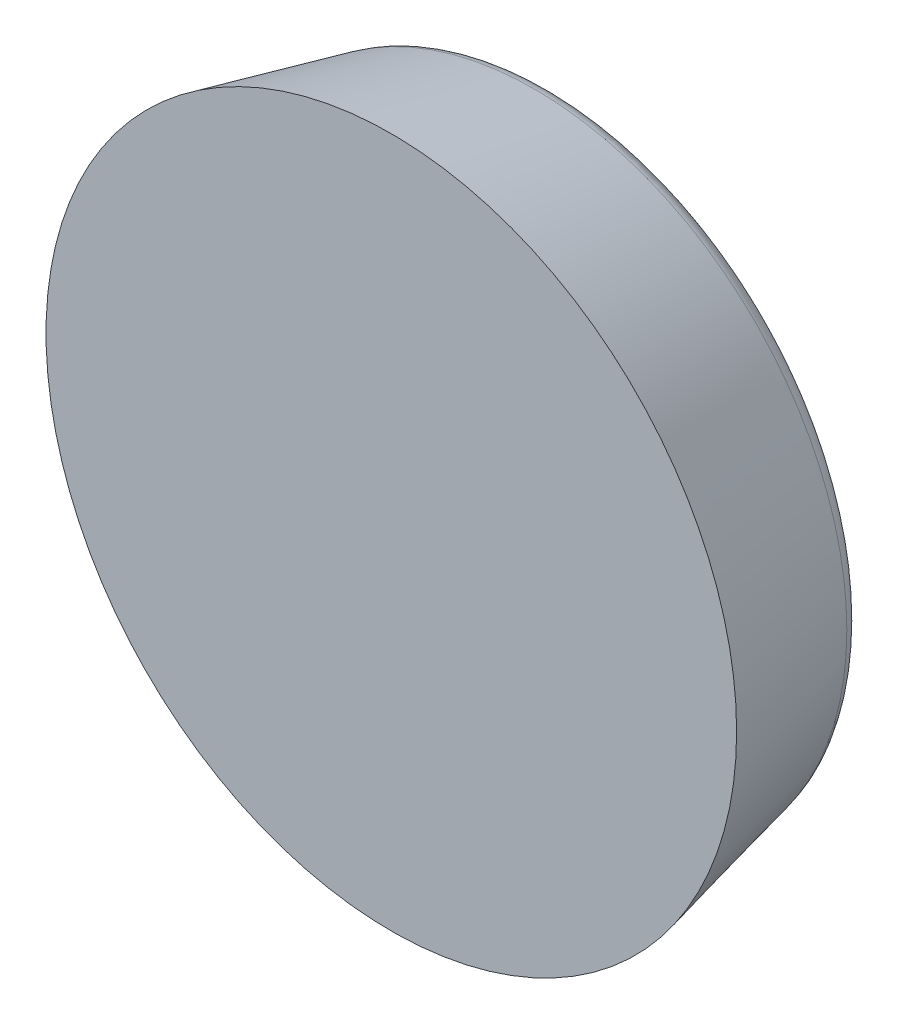
from build123d import *

# Parameters (mm, degrees)
CROQUIS1_R              = 15
SALIENTE_EXTRUIR1_DEPTH = 7
SALIENTE_EXTRUIR1_DRAFT = -13
CROQUIS3_R              = 10
CORTAR_EXTRUIR1_DEPTH   = 3
REDONDEO4_R             = 1
REDONDEO5_R             = 1
CROQUIS4_R              = 2
CORTAR_EXTRUIR3_DEPTH   = 3.5


with BuildPart() as part:
    # Croquis1 → Saliente-Extruir1 (with draft: the straight prism first)
    with BuildSketch(Plane.XY):
        Circle(CROQUIS1_R)
    extrude(amount=-SALIENTE_EXTRUIR1_DEPTH)
    # Saliente-Extruir1: the draft: its side faces are tilted about the plane it starts from
    saliente_extruir1_sides = [part.faces().sort_by_distance(p)[0] for p in [
        (-15, 0, -3.5),
    ]]
    draft(saliente_extruir1_sides, Plane.XY, SALIENTE_EXTRUIR1_DRAFT)

    # Croquis3 → Cortar-Extruir1 (cut)
    with BuildSketch(Plane(origin=(0, 0, -7), x_dir=(-1, 0, 0), z_dir=(0, 0, -1))):
        Circle(CROQUIS3_R)
    extrude(amount=-CORTAR_EXTRUIR1_DEPTH, mode=Mode.SUBTRACT)

    # Redondeo4
    redondeo4_edges = [part.edges().sort_by_distance(p)[0] for p in [
        (10, 0, -7),
    ]]
    fillet(redondeo4_edges, radius=REDONDEO4_R)

    # Redondeo5
    redondeo5_edges = [part.edges().sort_by_distance(p)[0] for p in [
        (-13.383922662, 0, -7),
    ]]
    fillet(redondeo5_edges, radius=REDONDEO5_R)

    # Croquis4 → Cortar-Extruir3 (cut)
    with BuildSketch(Plane(origin=(0, 0, -4), x_dir=(-1, 0, 0), z_dir=(0, 0, -1))):
        with BuildLine():
            Line((6.184658438, 2), (8.5, 2))
            Line((8.5, 2), (8.5, -2))
            Line((8.5, -2), (6.184658438, -2))
            ThreePointArc((6.184658438, -2), (0, -6.5), (-6.184658438, -2))
            Line((-6.184658438, -2), (-8.5, -2))
            Line((-8.5, -2), (-8.5, 2))
            Line((-8.5, 2), (-6.184658438, 2))
            ThreePointArc((-6.184658438, 2), (0, 6.5), (6.184658438, 2))
        make_face()
        Circle(CROQUIS4_R, mode=Mode.SUBTRACT)
    extrude(amount=-CORTAR_EXTRUIR3_DEPTH, mode=Mode.SUBTRACT)


solid = part.part
